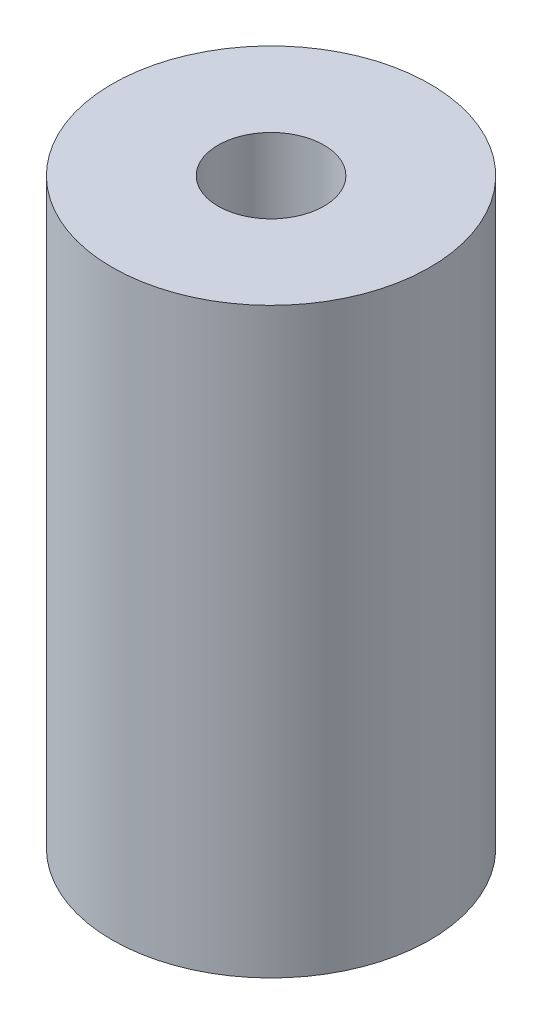
from build123d import *

# Parameters (mm, degrees)
SKETCH1_R           = 4.7625
SKETCH1_R_2         = 1.5875
BOSS_EXTRUDE1_DEPTH = 17.4625


with BuildPart() as part:
    # Sketch1 → Boss-Extrude1 (new body)
    with BuildSketch(Plane(origin=(0, 0, 0), x_dir=(1, 0, 0), z_dir=(0, 1, 0))):
        with Locations(Location((0, 0, 0), (0, 0, 270))):
            Circle(SKETCH1_R)
        with Locations(Location((0, 0, 0), (0, 0, 270))):
            Circle(SKETCH1_R_2, mode=Mode.SUBTRACT)
    extrude(amount=BOSS_EXTRUDE1_DEPTH)


solid = part.part
